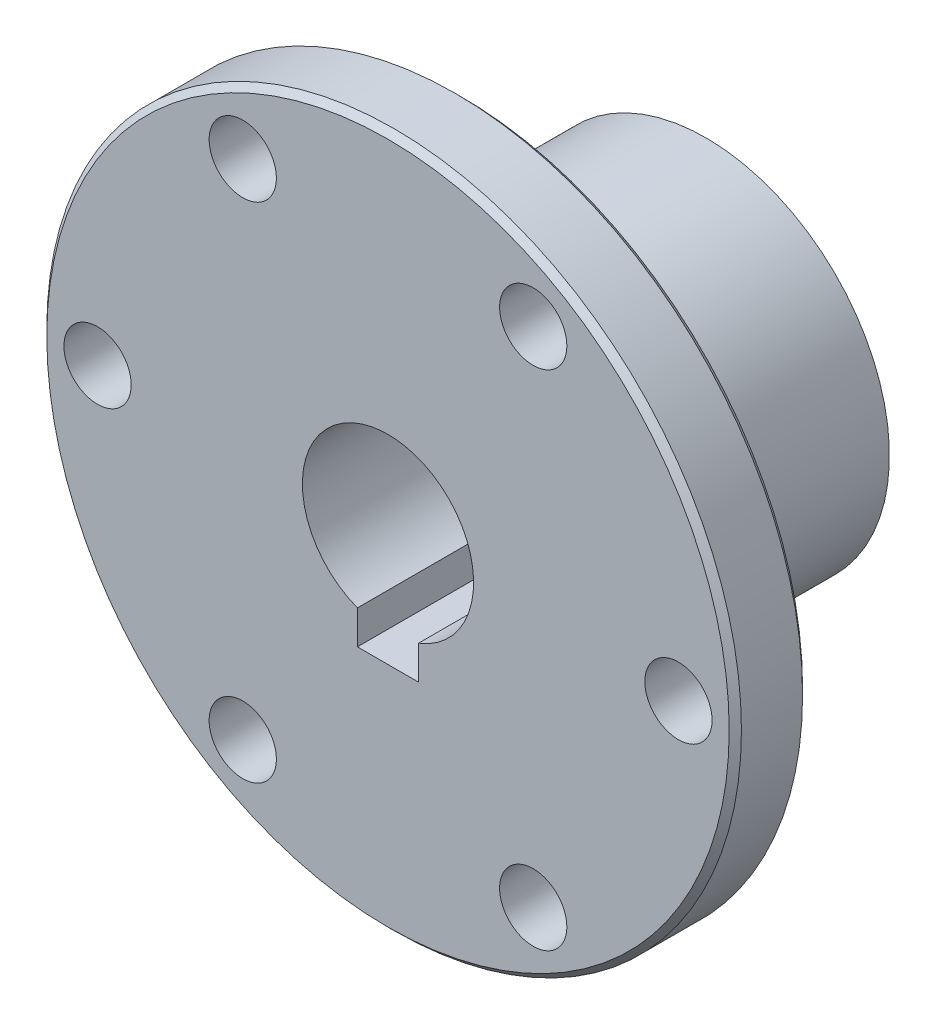
from build123d import *

# Parameters (mm, degrees)
SKETCH1_R            = 28.4
BOSS_EXTRUDE1_DEPTH  = 26
SKETCH2_OUTSIDE_W    = 75.686
SKETCH2_OUTSIDE_H    = 75.686
SKETCH2_OUTSIDE_R    = 15
CUT_EXTRUDE1_DEPTH   = 20
CUT_EXTRUDE2_DEPTH   = 48.844748928
CHAMFER1_SIZE        = 0.5
M5_CLEARANCE_HOLE1_D = 5.5
CIRPATTERN1_COUNT    = 6
SKETCH9_R            = 4
CUT_EXTRUDE3_DEPTH   = 48.844748928


with BuildPart() as part:
    # Sketch1 → Boss-Extrude1 (new body)
    with BuildSketch(Plane.XY):
        with Locations(Location((0, 0, 0), (0, 0, 180))):
            Circle(SKETCH1_R)
    extrude(amount=BOSS_EXTRUDE1_DEPTH)

    # Sketch2 outside → Cut-Extrude1 (cut)
    with BuildSketch(Plane(origin=(0, 0, 0), x_dir=(-1, 0, 0), z_dir=(0, 0, -1))):
        Rectangle(SKETCH2_OUTSIDE_W, SKETCH2_OUTSIDE_H)
        Circle(SKETCH2_OUTSIDE_R, mode=Mode.SUBTRACT)
    extrude(amount=-CUT_EXTRUDE1_DEPTH, mode=Mode.SUBTRACT)

    # Sketch3 → Cut-Extrude2 (cut, through all)
    with BuildSketch(Plane(origin=(0, 0, 0), x_dir=(-1, 0, 0), z_dir=(0, 0, -1))):
        with BuildLine():
            Line((2.5, -6.538348415), (2.5, -9.3))
            Line((2.5, -9.3), (-2.5, -9.3))
            Line((-2.5, -9.3), (-2.5, -6.538348415))
            ThreePointArc((-2.5, -6.538348415), (0, 7), (2.5, -6.538348415))
        make_face()
    extrude(amount=-CUT_EXTRUDE2_DEPTH, mode=Mode.SUBTRACT)

    # Chamfer1
    chamfer1_edges = [part.edges().sort_by_distance(p)[0] for p in [
        (28.4, 0, 26),
        (28.4, 0, 20),
    ]]
    chamfer(chamfer1_edges, length=CHAMFER1_SIZE)

    # M5 Clearance Hole1 (through all)
    with Locations(Plane.XY.offset(26)):
        with Locations((23.75, 0)):
            m5_clearance_hole1 = Hole(M5_CLEARANCE_HOLE1_D / 2)

    # CirPattern1: M5 Clearance Hole1 ×6 about axis
    cirpattern1_axis = Axis((0, 0, 0), (0, 0, 1))
    for i in range(1, CIRPATTERN1_COUNT):
        add(m5_clearance_hole1.rotate(cirpattern1_axis, i * 360 / CIRPATTERN1_COUNT), mode=Mode.SUBTRACT)

    # Sketch9 → Cut-Extrude3 (cut, through all)
    with BuildSketch(Plane(origin=(0, 0, 0), x_dir=(0, 0, -1), z_dir=(1, 0, 0))):
        with Locations((-10.2, 0)):
            Circle(SKETCH9_R)
    extrude(amount=-CUT_EXTRUDE3_DEPTH, mode=Mode.SUBTRACT)


solid = part.part
